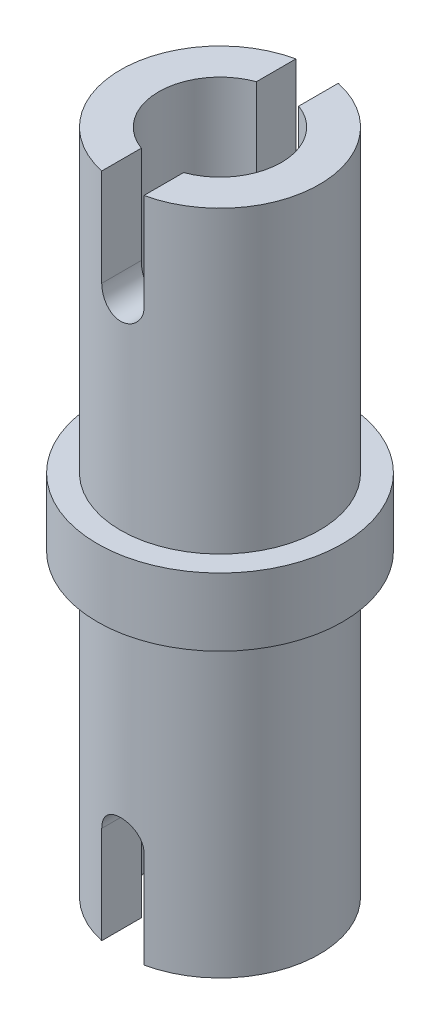
from build123d import *

# Parameters (mm, degrees)
SKETCH1_R           = 2.35
SKETCH1_R_2         = 1.45
BOSS_EXTRUDE1_DEPTH = 7.88
SKETCH2_R           = 2.9
SKETCH2_R_2         = 2.35
BOSS_EXTRUDE2_DEPTH = 0.8
CUT_EXTRUDE1_DEPTH  = 10.8


with BuildPart() as part:
    # Sketch1 → Boss-Extrude1 (new, symmetric)
    with BuildSketch(Plane(origin=(0, 0, 0), x_dir=(1, 0, 0), z_dir=(0, 1, 0))):
        with Locations(Location((0, 0, 0), (0, 0, 270))):
            Circle(SKETCH1_R)
        with Locations(Location((0, 0, 0), (0, 0, 270))):
            Circle(SKETCH1_R_2, mode=Mode.SUBTRACT)
    extrude(amount=BOSS_EXTRUDE1_DEPTH, both=True)

    # Sketch2 → Boss-Extrude2 (add, symmetric)
    with BuildSketch(Plane(origin=(0, 0, 0), x_dir=(1, 0, 0), z_dir=(0, 1, 0))):
        with Locations(Location((0, 0, 0), (0, 0, 270))):
            Circle(SKETCH2_R)
        with Locations(Location((0, 0, 0), (0, 0, 270))):
            Circle(SKETCH2_R_2, mode=Mode.SUBTRACT)
    extrude(amount=BOSS_EXTRUDE2_DEPTH, both=True)

    # Sketch3 → Cut-Extrude1 (cut, symmetric)
    with BuildSketch(Plane.XY):
        with BuildLine():
            Line((0.5, 7.88), (0.5, 5.58))
            ThreePointArc((0.5, 5.58), (0, 5.08), (-0.5, 5.58))
            Line((-0.5, 5.58), (-0.5, 7.88))
            ThreePointArc((-0.5, 7.88), (0, 8.38), (0.5, 7.88))
        make_face()
        with BuildLine():
            Line((0.5, -7.88), (0.5, -5.58))
            ThreePointArc((0.5, -5.58), (0, -5.08), (-0.5, -5.58))
            Line((-0.5, -5.58), (-0.5, -7.88))
            ThreePointArc((-0.5, -7.88), (0, -8.38), (0.5, -7.88))
        make_face()
    extrude(amount=CUT_EXTRUDE1_DEPTH, both=True, mode=Mode.SUBTRACT)


solid = part.part
